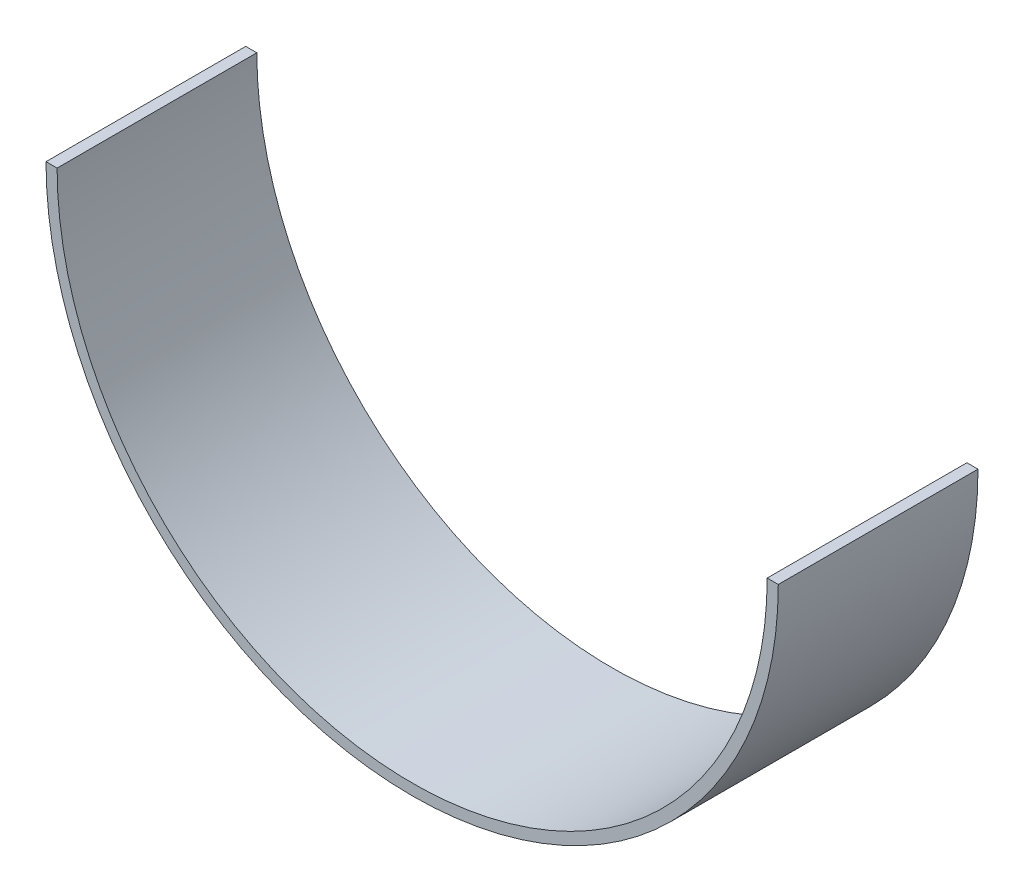
from build123d import *

# Parameters (mm, degrees)
SALIENTE_EXTRUIR1_DEPTH = 9


with BuildPart() as part:
    # Croquis1 → Saliente-Extruir1 (new, symmetric)
    with BuildSketch(Plane.XY):
        with BuildLine():
            Line((-32, 0), (-33, 0))
            ThreePointArc((-33, 0), (0, -33), (33, 0))
            Line((33, 0), (32, 0))
            ThreePointArc((32, 0), (0, -32), (-32, 0))
        make_face()
    extrude(amount=SALIENTE_EXTRUIR1_DEPTH, both=True)


solid = part.part
